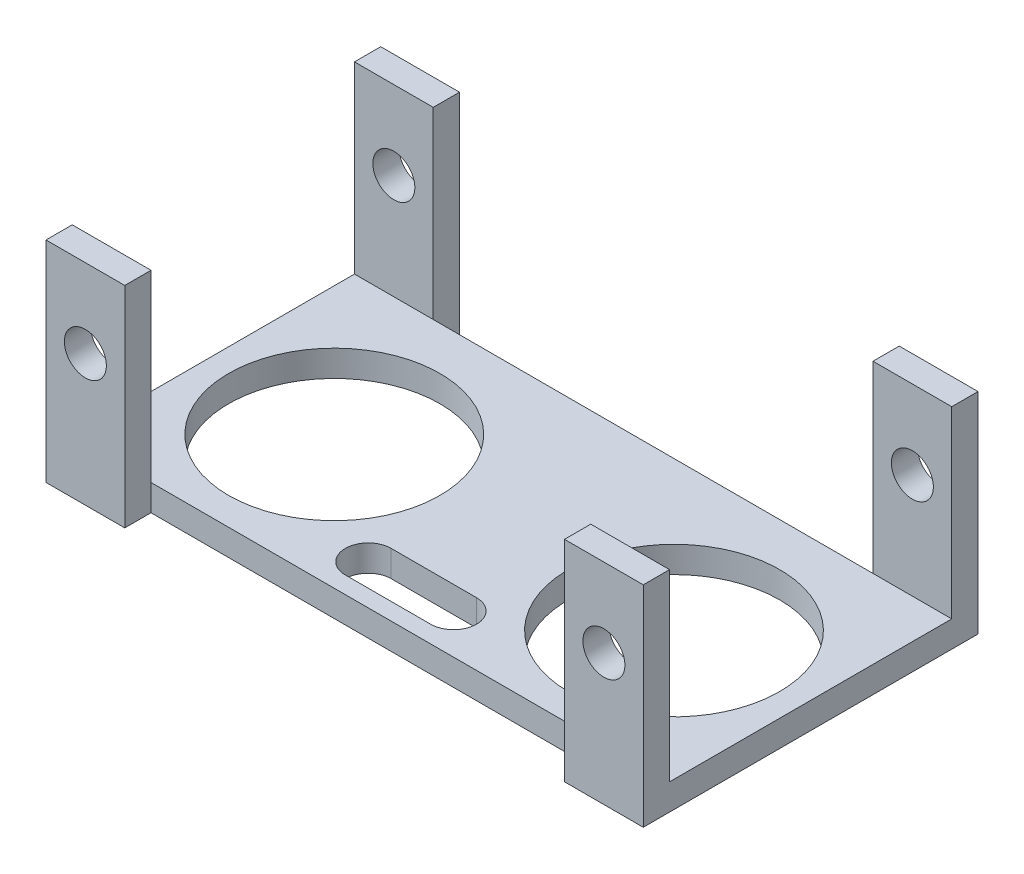
from build123d import *

# Parameters (mm, degrees)
SKETCH_1_W          = 45.5
SKETCH_1_H          = 21.5
EXTRUDE_1_DEPTH     = 1
SKETCH_2_W          = 6
SKETCH_2_H          = 15
EXTRUDE_2_DEPTH     = 2
SKETCH_3_R          = 8.05
CUT_EXTRUDE_1_DEPTH = 30.599408778
CUT_EXTRUDE_2_DEPTH = 30.599408778
SKETCH_5_R          = 1.6
CUT_EXTRUDE_3_DEPTH = 38.320403267
SKETCH_6_R          = 8.05
EXTRUDE_3_DEPTH     = 1


with BuildPart() as part:
    # 草圖1 → 填料-伸長1 (new body)
    with BuildSketch(Plane(origin=(0, 0, 0), x_dir=(1, 0, 0), z_dir=(0, 1, 0))):
        Rectangle(SKETCH_1_W, SKETCH_1_H)
    extrude(amount=EXTRUDE_1_DEPTH)

    # 草圖2 → 填料-伸長2 (add)
    with BuildSketch(Plane.XY.offset(10.75)):
        with Locations((-19.75, 7.5)):
            Rectangle(SKETCH_2_W, SKETCH_2_H)
        with Locations((19.75, 7.5)):
            Rectangle(SKETCH_2_W, SKETCH_2_H)
    extrude_2 = extrude(amount=EXTRUDE_2_DEPTH)

    # 鏡射1: 填料-伸長2 across plane
    add(extrude_2.mirror(Plane.XY))

    # 草圖3 → 除料-伸長1 (cut, through all)
    with BuildSketch(Plane(origin=(0, 1, 0), x_dir=(1, 0, 0), z_dir=(0, 1, 0))):
        with Locations(Location((-12.94, -0.6, 0), (0, 0, 270))):
            Circle(SKETCH_3_R)
        with Locations(Location((12.94, -0.6, 0), (0, 0, 270))):
            Circle(SKETCH_3_R)
    extrude(amount=-CUT_EXTRUDE_1_DEPTH, mode=Mode.SUBTRACT)

    # 草圖4 → 除料-伸長2 (cut, through all)
    with BuildSketch(Plane(origin=(0, 1, 0), x_dir=(1, 0, 0), z_dir=(0, 1, 0))):
        with BuildLine():
            Line((-3.25, -5.95), (3.25, -5.95))
            ThreePointArc((3.25, -5.95), (5, -7.7), (3.25, -9.45))
            Line((3.25, -9.45), (-3.25, -9.45))
            ThreePointArc((-3.25, -9.45), (-5, -7.7), (-3.25, -5.95))
        make_face()
    extrude(amount=-CUT_EXTRUDE_2_DEPTH, mode=Mode.SUBTRACT)

    # 草圖5 → 除料-伸長3 (cut, through all)
    with BuildSketch(Plane(origin=(0, 0, -12.75), x_dir=(-1, 0, 0), z_dir=(0, 0, -1))):
        with Locations((19.75, 9)):
            Circle(SKETCH_5_R)
        with Locations((-19.75, 9)):
            Circle(SKETCH_5_R)
    extrude(amount=-CUT_EXTRUDE_3_DEPTH, mode=Mode.SUBTRACT)

    # 草圖6 → 填料-伸長3 (add)
    with BuildSketch(Plane.XZ):
        Polygon((-22.75, 12.75), (-22.75, -12.75), (-16.75, -12.75), (-16.75, -10.75), (16.75, -10.75), (16.75, -12.75), (22.75, -12.75), (22.75, 12.75), (16.75, 12.75), (16.75, 10.75), (-16.75, 10.75), (-16.75, 12.75), align=None)
        with Locations(Location((-12.94, 0.6, 0), (0, 0, 90))):
            Circle(SKETCH_6_R, mode=Mode.SUBTRACT)
        with Locations(Location((12.94, 0.6, 0), (0, 0, 90))):
            Circle(SKETCH_6_R, mode=Mode.SUBTRACT)
        with BuildLine():
            Line((3.25, 5.95), (-3.25, 5.95))
            ThreePointArc((-3.25, 5.95), (-5, 7.7), (-3.25, 9.45))
            Line((-3.25, 9.45), (3.25, 9.45))
            ThreePointArc((3.25, 9.45), (5, 7.7), (3.25, 5.95))
        make_face(mode=Mode.SUBTRACT)
    extrude(amount=EXTRUDE_3_DEPTH)


solid = part.part
